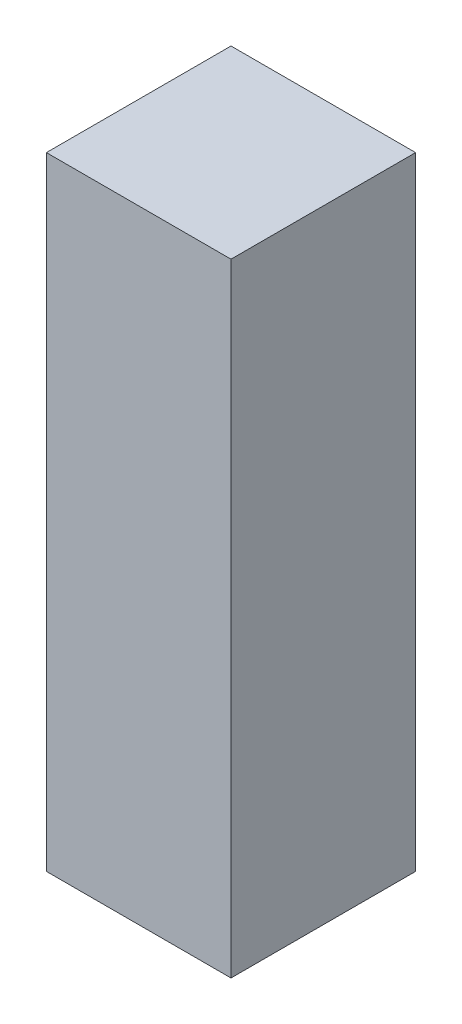
from build123d import *

# Parameters (mm, degrees)
ESQUISSE1_W        = 30.1
ESQUISSE1_H        = 30.1
BOSS_EXTRU_1_DEPTH = 101.5


with BuildPart() as part:
    # Esquisse1 → Boss.-Extru.1 (new body)
    with BuildSketch(Plane(origin=(0, 0, 0), x_dir=(1, 0, 0), z_dir=(0, 1, 0))):
        Rectangle(ESQUISSE1_W, ESQUISSE1_H)
    extrude(amount=BOSS_EXTRU_1_DEPTH)


solid = part.part
